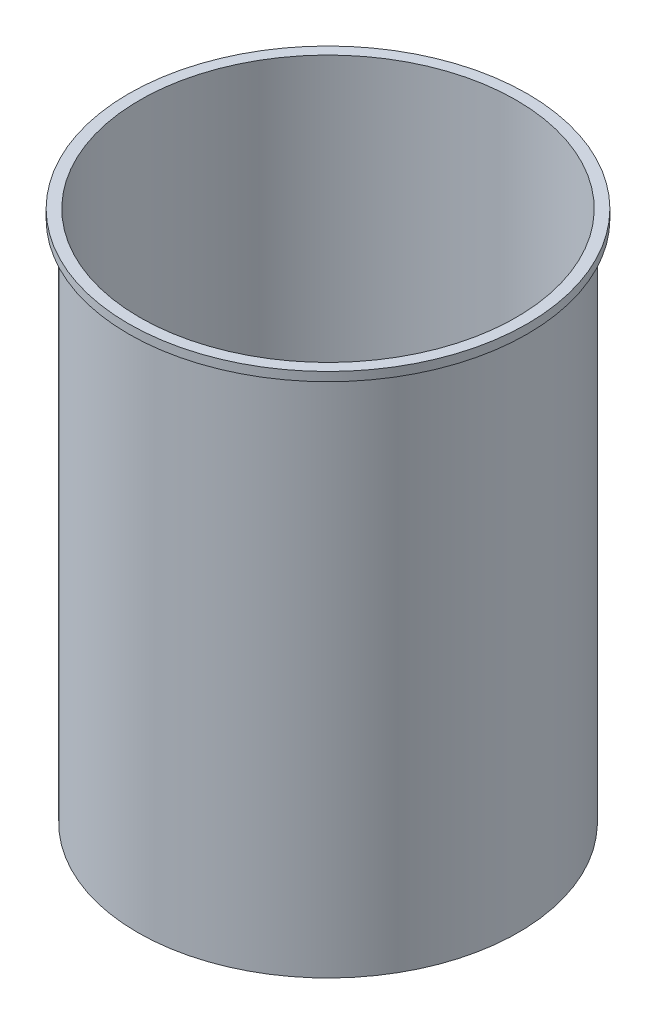
from build123d import *

# Parameters (mm, degrees)
SKETCH1_R           = 43
SKETCH1_R_2         = 42.5
BOSS_EXTRUDE1_DEPTH = 118
SKETCH2_R           = 45
SKETCH2_R_2         = 42.5
BOSS_EXTRUDE2_DEPTH = 2


with BuildPart() as part:
    # Sketch1 → Boss-Extrude1 (new body)
    with BuildSketch(Plane(origin=(0, 0, 0), x_dir=(1, 0, 0), z_dir=(0, 1, 0))):
        with Locations(Location((0, 0, 0), (0, 0, 270))):
            Circle(SKETCH1_R)
        with Locations(Location((0, 0, 0), (0, 0, 270))):
            Circle(SKETCH1_R_2, mode=Mode.SUBTRACT)
    extrude(amount=BOSS_EXTRUDE1_DEPTH)

    # Sketch2 → Boss-Extrude2 (add)
    with BuildSketch(Plane(origin=(0, 118, 0), x_dir=(1, 0, 0), z_dir=(0, 1, 0))):
        with Locations(Location((0, 0, 0), (0, 0, 270))):
            Circle(SKETCH2_R)
        with Locations(Location((0, 0, 0), (0, 0, 270))):
            Circle(SKETCH2_R_2, mode=Mode.SUBTRACT)
    extrude(amount=BOSS_EXTRUDE2_DEPTH)


solid = part.part
